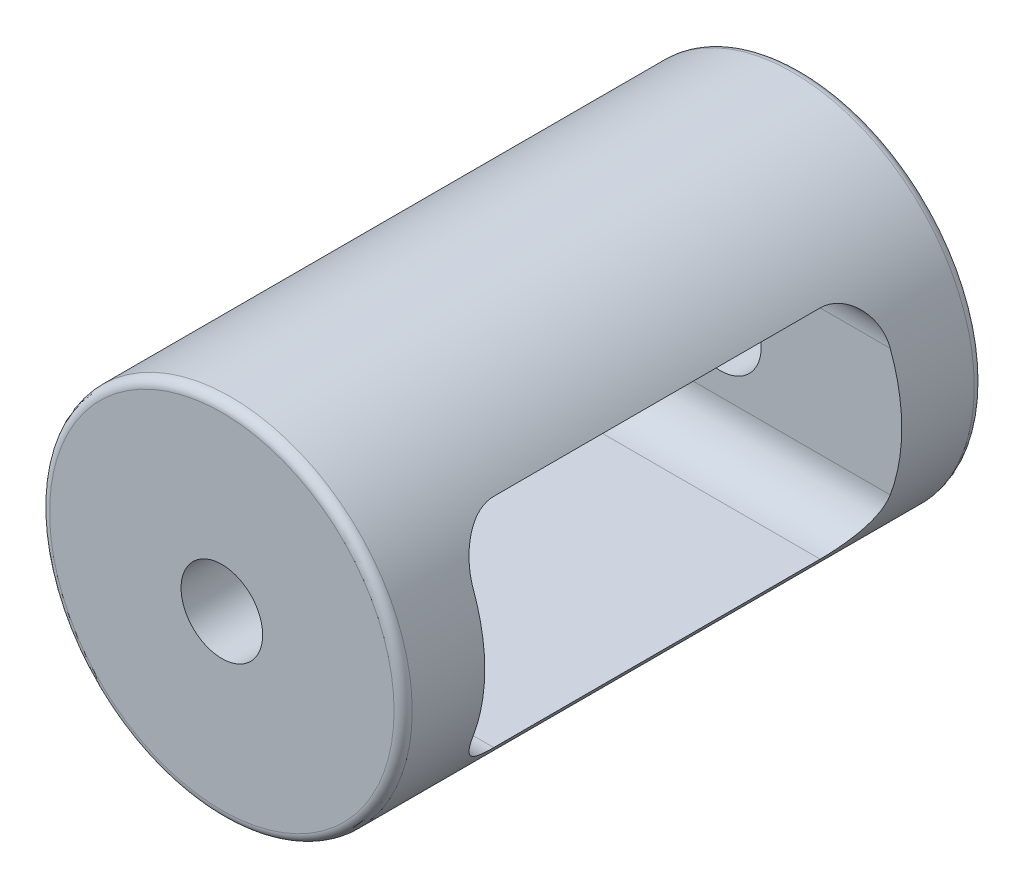
from build123d import *

# Parameters (mm, degrees)
BOSS_EXTRUDE1_DEPTH      = 16
BOSS_EXTRUDE1_DEPTH_BACK = 16
SKETCH1_R                = 10
SKETCH1_R_2              = 2.25
CUT_EXTRUDE1_DEPTH       = 22.354156504
CUT_EXTRUDE1_DEPTH_BACK  = 22.354156504
SKETCH2_W                = 23
SKETCH2_H                = 12
FILLET1_R                = 0.5
FILLET2_R                = 2.5


with BuildPart() as part:
    # Sketch1 → Boss-Extrude1 (new, two sides: drawn at the far end of the back side and taken through both)
    with BuildSketch(Plane.XY.offset(-BOSS_EXTRUDE1_DEPTH_BACK)):
        Circle(SKETCH1_R)
        Circle(SKETCH1_R_2, mode=Mode.SUBTRACT)
    extrude(amount=BOSS_EXTRUDE1_DEPTH + BOSS_EXTRUDE1_DEPTH_BACK)

    # Sketch2 → Cut-Extrude1 (cut, two sides: drawn at the far end of the back side and taken through both)
    with BuildSketch(Plane(origin=(0, 0, 0), x_dir=(0, 0, -1), z_dir=(1, 0, 0)).offset(-CUT_EXTRUDE1_DEPTH_BACK)):
        Rectangle(SKETCH2_W, SKETCH2_H)
    extrude(amount=CUT_EXTRUDE1_DEPTH + CUT_EXTRUDE1_DEPTH_BACK, mode=Mode.SUBTRACT)

    # Fillet1
    fillet1_edges = [part.edges().sort_by_distance(p)[0] for p in [
        (-10, 0, -16),
        (-10, 0, 16),
    ]]
    fillet(fillet1_edges, radius=FILLET1_R)

    # Fillet2
    fillet2_edges = [part.edges().sort_by_distance(p)[0] for p in [
        (0, 6, 11.5),
        (0, -6, 11.5),
        (0, -6, -11.5),
        (0, 6, -11.5),
    ]]
    fillet(fillet2_edges, radius=FILLET2_R)


solid = part.part
